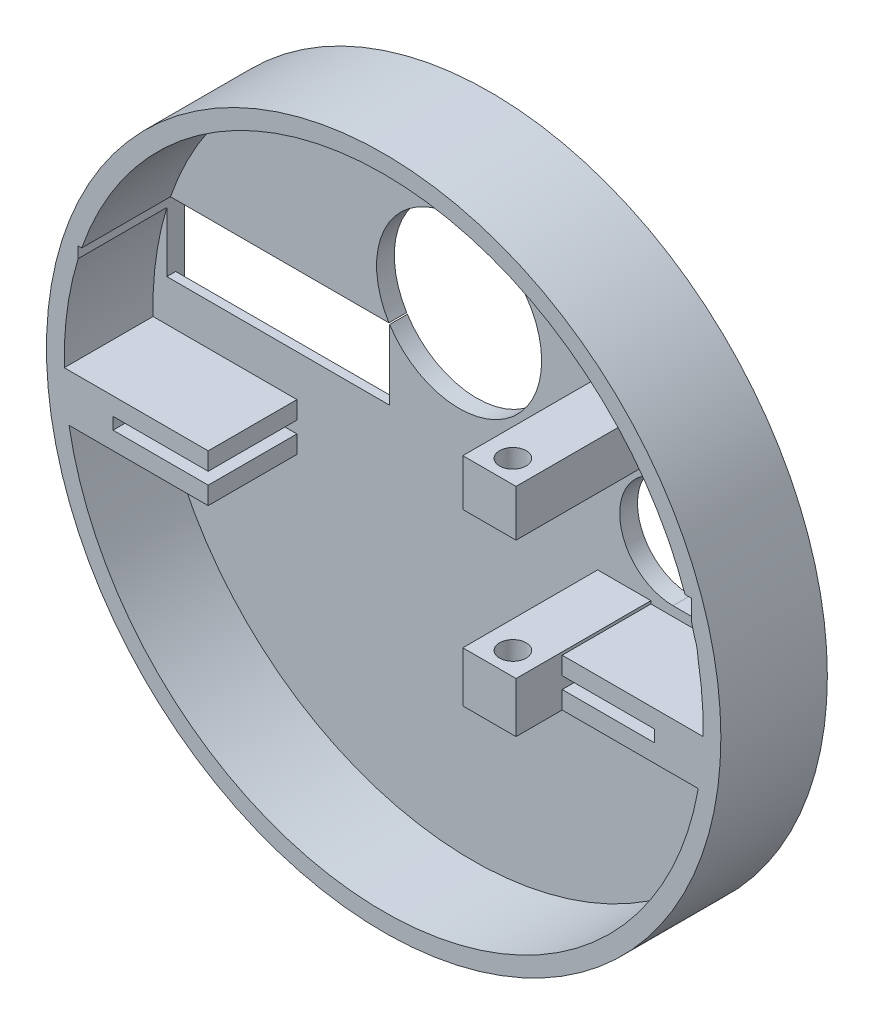
from build123d import *

# Parameters (mm, degrees)
SKETCH2_R               = 38
BOSS_EXTRUDE1_DEPTH     = 10
BOSS_EXTRUDE2_START     = -2
SKETCH3_R               = 38
BOSS_EXTRUDE2_DEPTH     = 2
CUT_EXTRUDE1_DEPTH      = 1
CUT_EXTRUDE2_DEPTH      = 11
CUT_EXTRUDE2_DEPTH_BACK = 11
SKETCH7_W               = 25.1
SKETCH7_H               = 8
CUT_EXTRUDE3_DEPTH      = 11
SKETCH9_W               = 6
SKETCH9_H               = 5.25
BOSS_EXTRUDE3_DEPTH     = 15.2
SKETCH11_W              = 5.2
SKETCH11_H              = 2
SKETCH11_H_2            = 1.576241261
BOSS_EXTRUDE4_DEPTH     = 0.34385041
BOSS_EXTRUDE5_DEPTH     = 0.423758738
SKETCH10_R              = 1.5
CUT_EXTRUDE5_DEPTH      = 30.2
SKETCH13_W              = 0.801888887
SKETCH13_H              = 5
CUT_EXTRUDE6_DEPTH      = 1


with BuildPart() as part:
    # Sketch2 → Boss-Extrude1 (new body)
    with BuildSketch(Plane.XY):
        with Locations((25.546999888, -56.770486832)):
            Circle(SKETCH2_R)
        with BuildLine():
            Line((45.320115794, -57.679532627), (45.320115794, -59.679532627))
            Line((45.320115794, -59.679532627), (56.046999888, -59.679532627))
            Line((56.046999888, -59.679532627), (56.046999888, -61.029532627))
            Line((56.046999888, -61.029532627), (45.320115794, -61.029532627))
            Line((45.320115794, -61.029532627), (45.320115794, -63.029532627))
            Line((45.320115794, -63.029532627), (60.998718404, -63.029532627))
            ThreePointArc((60.998718404, -63.029532627), (25.546999888, -92.770486832), (-9.904718628, -63.029532627))
            Line((-9.904718628, -63.029532627), (5.773883981, -63.029532627))
            Line((5.773883981, -63.029532627), (5.773883981, -61.029532627))
            Line((5.773883981, -61.029532627), (-4.953000112, -61.029532627))
            Line((-4.953000112, -61.029532627), (-4.953000112, -59.679532627))
            Line((-4.953000112, -59.679532627), (5.773883981, -59.679532627))
            Line((5.773883981, -59.679532627), (5.773883981, -57.679532627))
            Line((5.773883981, -57.679532627), (-10.441521001, -57.679532627))
            ThreePointArc((-10.441521001, -57.679532627), (19.044551487, -21.362604026), (59.510267865, -44.833300048))
            Line((59.510267865, -44.833300048), (60.246626043, -44.833300048))
            Line((60.246626043, -44.833300048), (60.246626043, -47.182163482))
            ThreePointArc((60.246626043, -47.182163482), (61.278669634, -52.383257966), (61.535520776, -57.679532627))
            Line((61.535520776, -57.679532627), (45.320115794, -57.679532627))
        make_face(mode=Mode.SUBTRACT)
    extrude(amount=BOSS_EXTRUDE1_DEPTH)

    # Sketch3 → Boss-Extrude2 (add)
    with BuildSketch(Plane.XY.offset(BOSS_EXTRUDE2_START)):
        with Locations((25.546999888, -56.770486832)):
            Circle(SKETCH3_R)
    extrude(amount=BOSS_EXTRUDE2_DEPTH)

    # Sketch5 → Cut-Extrude1 (cut)
    with BuildSketch(Plane(origin=(0, 0, -2), x_dir=(-1, 0, 0), z_dir=(0, 0, -1))):
        with BuildLine():
            Line((8.147567642, -45.005773888), (-16.21607418, -45.005773888))
            Line((-16.21607418, -45.005773888), (-16.21607418, -69.005773888))
            Line((-16.21607418, -69.005773888), (8.103151905, -69.005773888))
            ThreePointArc((8.103151905, -69.005773888), (8.51584011, -67.77556565), (8.88392582, -66.531284021))
            Line((8.88392582, -66.531284021), (8.88392582, -47.354637323))
            ThreePointArc((8.88392582, -47.354637323), (8.535828707, -46.173909996), (8.147567642, -45.005773888))
        make_face()
        with BuildLine():
            ThreePointArc((-48.150499089, -56.605773888), (-42.150499089, -50.605773888), (-48.150499089, -44.605773888))
            Line((-48.150499089, -44.605773888), (-54.980546295, -44.605773888))
            ThreePointArc((-54.980546295, -44.605773888), (-60.980546295, -50.605773888), (-54.980546295, -56.605773888))
            Line((-54.980546295, -56.605773888), (-48.150499089, -56.605773888))
        make_face()
    extrude(amount=-CUT_EXTRUDE1_DEPTH, mode=Mode.SUBTRACT)

    # Sketch7 → Cut-Extrude2 (cut, two sides: drawn at the far end of the back side and taken through both)
    with BuildSketch(Plane(origin=(0, 0, -1), x_dir=(-1, 0, 0), z_dir=(0, 0, -1)).offset(-CUT_EXTRUDE2_DEPTH_BACK)):
        with BuildLine():
            Line((-54.980546295, -56.605773888), (-48.150499089, -56.605773888))
            ThreePointArc((-48.150499089, -56.605773888), (-42.150499089, -50.605773888), (-48.150499089, -44.605773888))
            Line((-48.150499089, -44.605773888), (-54.980546295, -44.605773888))
            ThreePointArc((-54.980546295, -44.605773888), (-60.980546295, -50.605773888), (-54.980546295, -56.605773888))
        make_face()
        with Locations((-3.66607418, -49.005773888)):
            Rectangle(SKETCH7_W, SKETCH7_H)
    extrude(amount=CUT_EXTRUDE2_DEPTH + CUT_EXTRUDE2_DEPTH_BACK, mode=Mode.SUBTRACT)

    # Sketch8 → Cut-Extrude3 (cut)
    with BuildSketch(Plane.XY):
        with BuildLine():
            ThreePointArc((33.348311059, -40.109893754), (21.503210737, -31.164925093), (16.141329479, -45.005773888))
            Line((16.141329479, -45.005773888), (16.21607418, -45.005773888))
            Line((16.21607418, -45.005773888), (16.21607418, -45.124479027))
            ThreePointArc((16.21607418, -45.124479027), (26.660800008, -49.035413431), (33.348311059, -40.109893754))
        make_face()
        with BuildLine():
            Line((16.21607418, -45.005773888), (16.141329479, -45.005773888))
            ThreePointArc((16.141329479, -45.005773888), (16.178478014, -45.065267387), (16.21607418, -45.124479027))
            Line((16.21607418, -45.124479027), (16.21607418, -45.005773888))
        make_face()
    extrude(amount=-CUT_EXTRUDE3_DEPTH, mode=Mode.SUBTRACT)

    # Sketch9 → Boss-Extrude3 (add)
    with BuildSketch(Plane.XY):
        with Locations((42.663966204, -41.230773888)):
            Rectangle(SKETCH9_W, SKETCH9_H)
        Polygon((45.663966204, -57.355773888), (39.663966204, -57.355773888), (39.663966204, -62.605773888), (45.320115794, -62.605773888), (45.320115794, -61.029532627), (45.663966204, -61.029532627), (45.663966204, -59.679532627), (45.320115794, -59.679532627), (45.320115794, -57.679532627), (45.663966204, -57.679532627), align=None)
    extrude(amount=BOSS_EXTRUDE3_DEPTH)

    # Sketch11 → Boss-Extrude4 (add)
    with BuildSketch(Plane(origin=(45.320115794, 0, 0), x_dir=(0, 0, -1), z_dir=(1, 0, 0))):
        with Locations((-12.6, -58.679532627)):
            Rectangle(SKETCH11_W, SKETCH11_H)
        with Locations((-12.6, -61.817653257)):
            Rectangle(SKETCH11_W, SKETCH11_H_2)
    extrude(amount=BOSS_EXTRUDE4_DEPTH)

    # Sketch12 → Boss-Extrude5 (add)
    with BuildSketch(Plane.XZ.offset(62.605773888)):
        Polygon((39.663966204, 0), (45.320115794, 0), (45.320115794, 10), (45.663966204, 10), (45.663966204, 15.2), (39.663966204, 15.2), align=None)
    extrude(amount=BOSS_EXTRUDE5_DEPTH)

    # Sketch10 → Cut-Extrude5 (cut)
    with BuildSketch(Plane(origin=(0, -38.605773888, 0), x_dir=(1, 0, 0), z_dir=(0, 1, 0))):
        with Locations(Location((42.746446905, -12.639663568, 0), (0, 0, 270))):
            Circle(SKETCH10_R)
    extrude(amount=-CUT_EXTRUDE5_DEPTH, mode=Mode.SUBTRACT)

    # Sketch13 → Cut-Extrude6 (cut)
    # profile 1 of 8: a face of its own
    with BuildSketch(Plane(origin=(0, 0, -2), x_dir=(-1, 0, 0), z_dir=(0, 0, -1))):
        with BuildLine():
            Line((-40.104244244, -77.420287824), (-39.919238625, -76.89350522))
            add(Edge.make_bspline(
                [(-39.919238625, -76.89350522), (-39.985054462, -76.864755772), (-40.099036406, -76.827670091), (-40.269326593, -76.784978266), (-40.433726419, -76.750793916), (-40.622659337, -76.719221552), (-40.923593217, -76.68878046), (-41.161873876, -76.681558637), (-41.328515256, -76.679507378)],
                knots=[0, 0, 0, 0, 0.150125799, 0.250435981, 0.367340124, 0.501482822, 0.651140633, 1, 1, 1, 1], degree=3))
            add(Edge.make_bspline(
                [(-41.328515256, -76.679507378), (-41.551118359, -76.682349051), (-41.878080869, -76.705107722), (-42.297375573, -76.784199814), (-42.588134212, -76.861666839), (-42.860217223, -76.96378297), (-43.115298375, -77.086364928), (-43.352377266, -77.230635878), (-43.570737258, -77.395446782), (-43.768586362, -77.578162482), (-43.940626331, -77.77856157), (-44.088243958, -77.993415447), (-44.208456776, -78.224037529), (-44.303291152, -78.469702927), (-44.398543708, -78.823687705), (-44.424363123, -79.10307879), (-44.42885831, -79.2920717)],
                knots=[0, 0, 0, 0, 0.14690636, 0.215514431, 0.281217447, 0.345141972, 0.406923098, 0.467644647, 0.527895849, 0.58710749, 0.644941933, 0.701759103, 0.758694972, 0.816084307, 0.875151254, 1, 1, 1, 1], degree=3))
            add(Edge.make_bspline(
                [(-44.42885831, -79.2920717), (-44.426031396, -79.486385517), (-44.396500906, -79.770583678), (-44.304866617, -80.130869848), (-44.212364843, -80.375892275), (-44.095365607, -80.602699721), (-43.952072876, -80.810270398), (-43.785409494, -81.00030132), (-43.593503229, -81.169054285), (-43.383016352, -81.318726034), (-43.15737618, -81.449925507), (-42.917197587, -81.560675047), (-42.662616673, -81.650671869), (-42.393773518, -81.721686307), (-42.007784356, -81.789137586), (-41.708668421, -81.809337581), (-41.505402049, -81.809224359)],
                knots=[0, 0, 0, 0, 0.134054828, 0.196187605, 0.256037942, 0.314374007, 0.371821189, 0.429644386, 0.488326952, 0.547713857, 0.60759415, 0.668157831, 0.729921145, 0.793672145, 0.859786589, 1, 1, 1, 1], degree=3))
            add(Edge.make_bspline(
                [(-41.505402049, -81.809224359), (-41.333410545, -81.807122474), (-41.084443573, -81.799517854), (-40.765397705, -81.768840057), (-40.554487288, -81.737795521), (-40.364707434, -81.701640626), (-40.156901483, -81.653296502), (-40.013719027, -81.612905596), (-39.928429493, -81.578735508)],
                knots=[0, 0, 0, 0, 0.322335604, 0.466303064, 0.600284204, 0.721615014, 0.82815434, 1, 1, 1, 1], degree=3))
            Line((-39.928429493, -81.578735508), (-40.086584879, -81.068276407))
            add(Edge.make_bspline(
                [(-40.086584879, -81.068276407), (-40.171611189, -81.101493752), (-40.30657226, -81.146483426), (-40.497283578, -81.191391532), (-40.825450429, -81.25314188), (-41.108885014, -81.275623379), (-41.338163627, -81.276419899)],
                knots=[0, 0, 0, 0, 0.214735163, 0.334000252, 0.4606071, 1, 1, 1, 1], degree=3))
            add(Edge.make_bspline(
                [(-41.338163627, -81.276419899), (-41.510005248, -81.275914135), (-41.760830088, -81.256612925), (-42.082580191, -81.199084831), (-42.302064223, -81.139444563), (-42.505273326, -81.061809025), (-42.69374664, -80.969672613), (-42.865939974, -80.85993191), (-43.021825866, -80.734239277), (-43.160660588, -80.594136459), (-43.28258322, -80.441837951), (-43.384959772, -80.275869028), (-43.469946918, -80.098892901), (-43.535875196, -79.908969976), (-43.598992895, -79.633520332), (-43.619598338, -79.417687433), (-43.619467229, -79.270630877)],
                knots=[0, 0, 0, 0, 0.15004045, 0.219227057, 0.285263153, 0.348397162, 0.408984868, 0.468216069, 0.526376485, 0.583545824, 0.640194637, 0.696412641, 0.753518027, 0.811369344, 0.871641, 1, 1, 1, 1], degree=3))
            add(Edge.make_bspline(
                [(-43.619467229, -79.270630877), (-43.617636925, -79.114705853), (-43.597149875, -78.88577308), (-43.527547461, -78.594835206), (-43.456604372, -78.396437312), (-43.367004699, -78.212773824), (-43.259438979, -78.042522237), (-43.130649567, -77.887881571), (-42.984789233, -77.747148198), (-42.822094854, -77.62282396), (-42.645363068, -77.514036366), (-42.454553552, -77.421708998), (-42.250361244, -77.345601387), (-42.032533856, -77.286473016), (-41.716414469, -77.230720949), (-41.470669745, -77.212216707), (-41.302786268, -77.212311838)],
                knots=[0, 0, 0, 0, 0.133608295, 0.195976265, 0.255816817, 0.313729074, 0.370711517, 0.427897521, 0.485702881, 0.543992557, 0.602953592, 0.663194488, 0.725286128, 0.789374094, 0.856264557, 1, 1, 1, 1], degree=3))
            add(Edge.make_bspline(
                [(-41.302786268, -77.212311838), (-41.183720381, -77.215324772), (-41.00941851, -77.221832998), (-40.784688007, -77.247779023), (-40.629894893, -77.269217953), (-40.484815105, -77.29878616), (-40.308200377, -77.341965395), (-40.183523487, -77.387908531), (-40.104244244, -77.420287824)],
                knots=[0, 0, 0, 0, 0.292162388, 0.427031541, 0.554525321, 0.675141959, 0.789885124, 1, 1, 1, 1], degree=3))
        make_face()
    # profile 2 of 8: a face of its own
    with BuildSketch(Plane(origin=(0, 0, -2), x_dir=(-1, 0, 0), z_dir=(0, 0, -1))):
        with BuildLine():
            Line((-39.072940642, -81.743830895), (-38.271051756, -81.743830895))
            Line((-38.271051756, -81.743830895), (-38.271051756, -79.548290586))
            Line((-38.271051756, -79.548290586), (-37.542296178, -79.548290586))
            add(Edge.make_bspline(
                [(-37.542296178, -79.548290586), (-37.460927165, -79.551848822), (-37.342079172, -79.559952537), (-37.189553329, -79.586263277), (-37.085678143, -79.612444724), (-36.990001831, -79.647418472), (-36.900961532, -79.686919632), (-36.819233771, -79.733670014), (-36.745528549, -79.789643167), (-36.677318565, -79.852126403), (-36.614814129, -79.923337557), (-36.558347658, -80.003827619), (-36.503704784, -80.091289976), (-36.457798153, -80.19003106), (-36.396535297, -80.335349471), (-36.362866615, -80.452606341), (-36.343523833, -80.533495371)],
                knots=[0, 0, 0, 0, 0.14326879, 0.208951182, 0.271875185, 0.33128654, 0.387797679, 0.442962574, 0.496357282, 0.550149584, 0.605343085, 0.662520635, 0.722851415, 0.786346628, 0.853657941, 1, 1, 1, 1], degree=3))
            add(Edge.make_bspline(
                [(-36.343523833, -80.533495371), (-36.307360806, -80.679658413), (-36.245887827, -80.886249944), (-36.172934839, -81.149914949), (-36.1206278, -81.315249423), (-36.075512627, -81.458876407), (-36.020017914, -81.600383484), (-35.981797232, -81.69478214), (-35.949012684, -81.744901889)],
                knots=[0, 0, 0, 0, 0.35368249, 0.506518283, 0.642777006, 0.761213721, 0.860089839, 1, 1, 1, 1], degree=3))
            Line((-35.949012684, -81.744901889), (-35.171586018, -81.743830895))
            add(Edge.make_bspline(
                [(-35.171586018, -81.743830895), (-35.209472299, -81.680101131), (-35.258101821, -81.566643814), (-35.322309856, -81.398263236), (-35.376265226, -81.235919501), (-35.434204564, -81.050085609), (-35.520316261, -80.754216174), (-35.579949217, -80.518228992), (-35.623112169, -80.353392455)],
                knots=[0, 0, 0, 0, 0.151417113, 0.252398818, 0.369031531, 0.501655205, 0.651028209, 1, 1, 1, 1], degree=3))
            add(Edge.make_bspline(
                [(-35.623112169, -80.353392455), (-35.656152173, -80.230713566), (-35.71549081, -80.052987181), (-35.832976746, -79.84008722), (-35.929859539, -79.699301887), (-36.043451095, -79.576235639), (-36.220401237, -79.437426771), (-36.376241992, -79.367035461), (-36.485033267, -79.333881306)],
                knots=[0, 0, 0, 0, 0.272813509, 0.398602998, 0.520133142, 0.638268868, 0.75608641, 1, 1, 1, 1], degree=3))
            Line((-36.485033267, -79.333881306), (-36.484711864, -79.319577304))
            add(Edge.make_bspline(
                [(-36.484711864, -79.319577304), (-36.407353816, -79.299411684), (-36.294650268, -79.260954484), (-36.151871786, -79.195875809), (-36.050541352, -79.142407445), (-35.954904925, -79.08215084), (-35.86450475, -79.015609808), (-35.780058376, -78.942376622), (-35.70014409, -78.864586639), (-35.628498686, -78.779797319), (-35.56476175, -78.689724613), (-35.510855848, -78.593293474), (-35.465998133, -78.491724112), (-35.429959837, -78.384166205), (-35.395713816, -78.230346337), (-35.38510803, -78.11035658), (-35.382974948, -78.029207206)],
                knots=[0, 0, 0, 0, 0.130854223, 0.194484618, 0.256782832, 0.318309634, 0.379398059, 0.440388328, 0.50120996, 0.561820135, 0.621882741, 0.681613823, 0.742390406, 0.803450803, 0.867043523, 1, 1, 1, 1], degree=3))
            add(Edge.make_bspline(
                [(-35.382974948, -78.029207206), (-35.384249581, -77.932834562), (-35.397978423, -77.789701197), (-35.44881354, -77.607346027), (-35.50161366, -77.479942386), (-35.566863384, -77.36017042), (-35.672135848, -77.214383628), (-35.766622372, -77.118029195), (-35.837520402, -77.063298116)],
                knots=[0, 0, 0, 0, 0.261905724, 0.387865696, 0.512744574, 0.635647397, 0.757360791, 1, 1, 1, 1], degree=3))
            add(Edge.make_bspline(
                [(-35.837520402, -77.063298116), (-35.932188383, -76.993127175), (-36.092508039, -76.904454824), (-36.329059622, -76.818921809), (-36.531024548, -76.76528192), (-36.754885418, -76.72558002), (-37.099388934, -76.683513133), (-37.371538963, -76.676690563), (-37.560290557, -76.676291254)],
                knots=[0, 0, 0, 0, 0.196743967, 0.304307766, 0.419971224, 0.545726921, 0.684173603, 1, 1, 1, 1], degree=3))
            add(Edge.make_bspline(
                [(-37.560290557, -76.676291254), (-37.828080772, -76.677014392), (-38.160452629, -76.6860576), (-38.552822667, -76.713813501), (-38.789625073, -76.736531069), (-38.961899628, -76.756404887), (-39.072940642, -76.773847001)],
                knots=[0, 0, 0, 0, 0.529594647, 0.657124324, 0.777787018, 1, 1, 1, 1], degree=3))
            Line((-39.072940642, -76.773847001), (-39.072940642, -81.743830895))
        make_face()
        with BuildLine():
            Line((-37.48095951, -79.076591426), (-38.271051756, -79.076591426))
            Line((-38.271051756, -79.076591426), (-38.271051756, -77.207615376))
            add(Edge.make_bspline(
                [(-38.271051756, -77.207615376), (-38.232016991, -77.196840319), (-38.166505407, -77.185745807), (-38.071066266, -77.174032113), (-37.981734626, -77.165235529), (-37.880153312, -77.159395029), (-37.720818645, -77.151849712), (-37.59534546, -77.148355564), (-37.50776054, -77.147989368)],
                knots=[0, 0, 0, 0, 0.158137914, 0.259552694, 0.376096226, 0.509138643, 0.65745551, 1, 1, 1, 1], degree=3))
            add(Edge.make_bspline(
                [(-37.50776054, -77.147989368), (-37.409052415, -77.149132246), (-37.264268059, -77.15443253), (-37.07765645, -77.179802597), (-36.948897609, -77.203773336), (-36.828151362, -77.236110092), (-36.715103922, -77.275586781), (-36.609933711, -77.32308064), (-36.512075746, -77.376100421), (-36.423431894, -77.436862466), (-36.346465308, -77.507116762), (-36.28141853, -77.586385613), (-36.227914685, -77.673878523), (-36.183724767, -77.769136693), (-36.144159719, -77.912746557), (-36.13073988, -78.026344914), (-36.1291156, -78.104250088)],
                knots=[0, 0, 0, 0, 0.156480209, 0.229013275, 0.298179052, 0.363814758, 0.42683523, 0.487645763, 0.546422494, 0.602953773, 0.657444431, 0.710935013, 0.764819527, 0.819539052, 0.876690458, 1, 1, 1, 1], degree=3))
            add(Edge.make_bspline(
                [(-36.1291156, -78.104250088), (-36.130441378, -78.175264932), (-36.142429077, -78.27981526), (-36.181459091, -78.412483911), (-36.223077101, -78.50366597), (-36.273119977, -78.590535061), (-36.336392569, -78.670532036), (-36.410922068, -78.744017293), (-36.494438391, -78.813458598), (-36.589069779, -78.873565388), (-36.691253666, -78.927836711), (-36.802303488, -78.972872571), (-36.922106565, -79.00861089), (-37.04970672, -79.039162196), (-37.236537898, -79.067994828), (-37.381798689, -79.075231546), (-37.48095951, -79.076591426)],
                knots=[0, 0, 0, 0, 0.114278379, 0.168309448, 0.221848701, 0.275202354, 0.329267071, 0.385378573, 0.443396432, 0.50368652, 0.565418225, 0.629380707, 0.696135802, 0.766432636, 0.840361, 1, 1, 1, 1], degree=3))
        make_face(mode=Mode.SUBTRACT)
    # profile 3 of 8: a face of its own
    with BuildSketch(Plane(origin=(0, 0, -2), x_dir=(-1, 0, 0), z_dir=(0, 0, -1))):
        Polygon((-31.238108894, -78.874152574), (-33.536917965, -78.874152574), (-33.536917965, -77.280748684), (-31.097185733, -77.280748684), (-31.097185733, -76.747223947), (-34.338806852, -76.747223947), (-34.338806852, -81.740437843), (-30.965070269, -81.740437843), (-30.965070269, -81.206913105), (-33.536917965, -81.206913105), (-33.536917965, -79.407677312), (-31.238108894, -79.407677312), align=None)
    # profile 4 of 8: a face of its own
    with BuildSketch(Plane(origin=(0, 0, -2), x_dir=(-1, 0, 0), z_dir=(0, 0, -1))):
        Polygon((-26.945642454, -80.165786298), (-26.316086279, -81.743830895), (-25.503038324, -81.743830895), (-27.513991779, -76.747223947), (-28.423350698, -76.747223947), (-30.434432924, -81.743830895), (-29.638743869, -81.743830895), (-29.035419202, -80.165786298), align=None)
        with BuildLine():
            Line((-28.878030158, -79.694087138), (-28.300936997, -78.209519505))
            add(Edge.make_bspline(
                [(-28.300936997, -78.209519505), (-28.133758621, -77.752369865), (-28.012691929, -77.280922472)],
                knots=[0, 0, 0, 1, 1, 1], degree=2))
            Line((-28.012691929, -77.280922472), (-27.98615891, -77.280747637))
            add(Edge.make_bspline(
                [(-27.98615891, -77.280747637), (-27.945733289, -77.433455556), (-27.848294072, -77.747461477), (-27.740616119, -78.058069123), (-27.680359167, -78.217886452)],
                knots=[0, 0, 0, 0, 0.480444352, 1, 1, 1, 1], degree=3))
            Line((-27.680359167, -78.217886452), (-27.103031498, -79.694087138))
            Line((-27.103031498, -79.694087138), (-28.878030158, -79.694087138))
        make_face(mode=Mode.SUBTRACT)
    # profile 5 of 8: a face of its own
    with BuildSketch(Plane(origin=(0, 0, -2), x_dir=(-1, 0, 0), z_dir=(0, 0, -1))):
        Polygon((-23.49832553, -81.743830895), (-22.696436644, -81.743830895), (-22.696436644, -77.280747637), (-20.88205094, -77.280747637), (-20.88205094, -76.747223947), (-25.303903536, -76.747223947), (-25.303903536, -77.280747637), (-23.49832553, -77.280747637), align=None)
    # profile 6 of 8: a face of its own
    with BuildSketch(Plane(origin=(0, 0, -2), x_dir=(-1, 0, 0), z_dir=(0, 0, -1))):
        with Locations((-19.872682305, -79.243830895)):
            Rectangle(SKETCH13_W, SKETCH13_H)
    # profile 7 of 8: a face of its own
    with BuildSketch(Plane(origin=(0, 0, -2), x_dir=(-1, 0, 0), z_dir=(0, 0, -1))):
        with BuildLine():
            Line((-17.413418823, -81.743830895), (-17.413418823, -79.607319853))
            add(Edge.make_bspline(
                [(-17.413418823, -79.607319853), (-17.414668072, -79.415055359), (-17.413538979, -79.133740714), (-17.421834508, -78.768545443), (-17.433499332, -78.278310661), (-17.454038012, -77.877352007), (-17.475599305, -77.560725217)],
                knots=[0, 0, 0, 0, 0.281664708, 0.412034862, 0.535090257, 1, 1, 1, 1], degree=3))
            Line((-17.475599305, -77.560725217), (-17.448738601, -77.552150981))
            add(Edge.make_bspline(
                [(-17.448738601, -77.552150981), (-17.290452417, -77.835938066), (-16.931257278, -78.400808494), (-16.536206449, -78.940877055), (-16.329587298, -79.215956778)],
                knots=[0, 0, 0, 0, 0.485600781, 1, 1, 1, 1], degree=3))
            Line((-16.329587298, -79.215956778), (-14.426594879, -81.743830895))
            Line((-14.426594879, -81.743830895), (-13.639830777, -81.743830895))
            Line((-13.639830777, -81.743830895), (-13.639830777, -76.750263142))
            Line((-13.639830777, -76.750263142), (-14.373109028, -76.750263142))
            Line((-14.373109028, -76.750263142), (-14.373109028, -78.853454014))
            add(Edge.make_bspline(
                [(-14.373109028, -78.853454014), (-14.37457794, -79.039694141), (-14.372000987, -79.313849858), (-14.36528407, -79.672337286), (-14.348166615, -80.176537866), (-14.319051947, -80.592286561), (-14.284132752, -80.922646315)],
                knots=[0, 0, 0, 0, 0.269628308, 0.396925557, 0.519093035, 1, 1, 1, 1], degree=3))
            Line((-14.284132752, -80.922646315), (-14.301567031, -80.929078562))
            add(Edge.make_bspline(
                [(-14.301567031, -80.929078562), (-14.375458458, -80.798709816), (-14.489687891, -80.601077668), (-14.653918018, -80.33944817), (-14.78413173, -80.135482074), (-14.923076098, -79.928854956), (-15.118584631, -79.642761586), (-15.272438913, -79.428720008), (-15.378686783, -79.285639453)],
                knots=[0, 0, 0, 0, 0.228665894, 0.348185411, 0.471297315, 0.597869182, 0.728080882, 1, 1, 1, 1], degree=3))
            Line((-15.378686783, -79.285639453), (-17.288967825, -76.743830895))
            Line((-17.288967825, -76.743830895), (-18.146697075, -76.743830895))
            Line((-18.146697075, -76.743830895), (-18.146697075, -81.743829848))
            Line((-18.146697075, -81.743829848), (-17.413418823, -81.743830895))
        make_face()
    # profile 8 of 8: a face of its own
    with BuildSketch(Plane(origin=(0, 0, -2), x_dir=(-1, 0, 0), z_dir=(0, 0, -1))):
        with BuildLine():
            Line((-10.209301138, -81.743830895), (-10.209301138, -79.614738294))
            Line((-10.209301138, -79.614738294), (-8.22756918, -76.743830895))
            Line((-8.22756918, -76.743830895), (-9.090723544, -76.743830895))
            Line((-9.090723544, -76.743830895), (-9.94507021, -78.123631629))
            add(Edge.make_bspline(
                [(-9.94507021, -78.123631629), (-10.057830815, -78.300491239), (-10.266790116, -78.641070162), (-10.466626513, -78.987127569), (-10.555573576, -79.154850431)],
                knots=[0, 0, 0, 0, 0.524939289, 1, 1, 1, 1], degree=3))
            Line((-10.555573576, -79.154850431), (-10.573797228, -79.154794945))
            add(Edge.make_bspline(
                [(-10.573797228, -79.154794945), (-10.66841177, -78.987777556), (-10.868167387, -78.643101676), (-11.073339551, -78.301629266), (-11.179501534, -78.12461887)],
                knots=[0, 0, 0, 0, 0.481858599, 1, 1, 1, 1], degree=3))
            Line((-11.179501534, -78.12461887), (-12.01526755, -76.743830895))
            Line((-12.01526755, -76.743830895), (-12.887229611, -76.743830895))
            Line((-12.887229611, -76.743830895), (-11.011190024, -79.629575176))
            Line((-11.011190024, -79.629575176), (-11.011190024, -81.743830895))
            Line((-11.011190024, -81.743830895), (-10.209301138, -81.743830895))
        make_face()
    extrude(amount=-CUT_EXTRUDE6_DEPTH, mode=Mode.SUBTRACT)


solid = part.part
